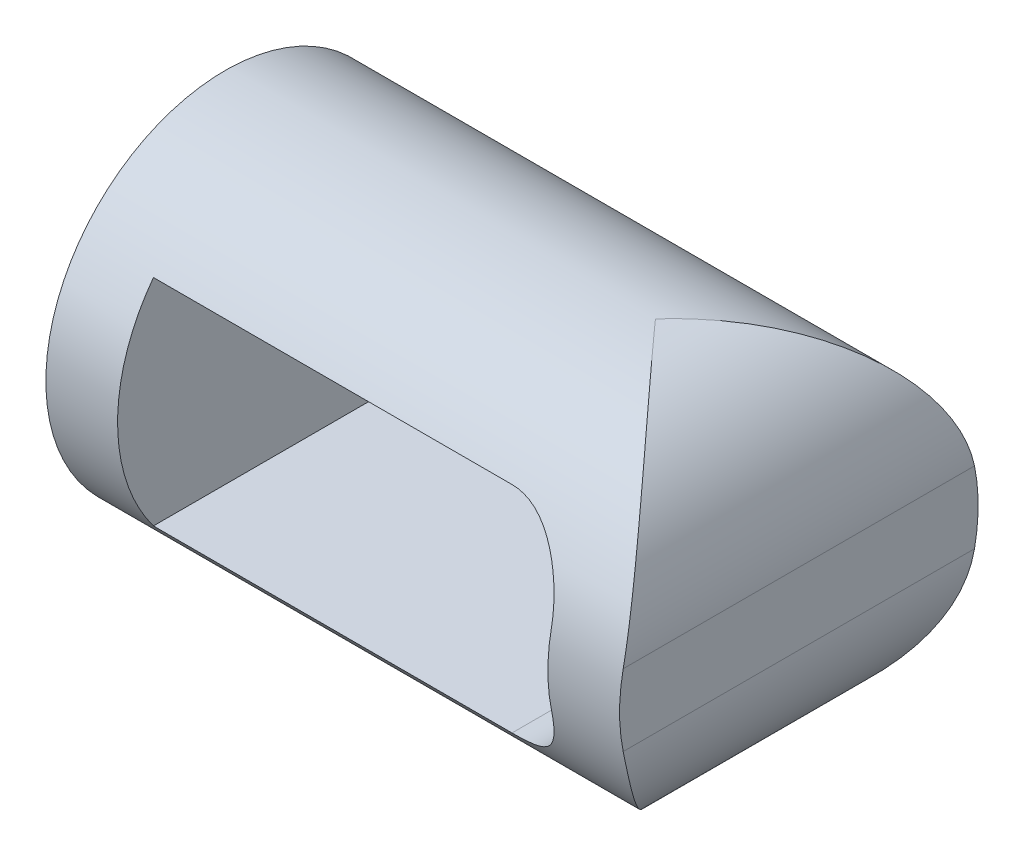
from build123d import *

# Parameters (mm, degrees)
SKETCH1_R               = 12.5
BOSS_EXTRUDE4_DEPTH     = 40
CUT_EXTRUDE2_DEPTH      = 44.732139211
CUT_EXTRUDE2_DEPTH_BACK = 44.732139211
CUT_EXTRUDE6_DEPTH      = 44.73213936
CUT_EXTRUDE6_DEPTH_BACK = 44.73213936
CUT_EXTRUDE7_DEPTH      = 44.73213936
CUT_EXTRUDE7_DEPTH_BACK = 44.73213936


with BuildPart() as part:
    # Sketch1 → Boss-Extrude4 (new body)
    with BuildSketch(Plane(origin=(0, 0, 0), x_dir=(0, 0, -1), z_dir=(1, 0, 0))):
        Circle(SKETCH1_R)
    extrude(amount=BOSS_EXTRUDE4_DEPTH)

    # Sketch2 → Cut-Extrude2 (cut, two sides: drawn at the far end of the back side and taken through both)
    with BuildSketch(Plane.XY.offset(-CUT_EXTRUDE2_DEPTH_BACK)):
        with BuildLine():
            Line((5, 0), (5, 7.5))
            Line((5, 7.5), (30, 7.5))
            ThreePointArc((30, 7.5), (33.535533906, 6.035533906), (35, 2.5))
            Line((35, 2.5), (35, -2.5))
            ThreePointArc((35, -2.5), (33.535533906, -6.035533906), (30, -7.5))
            Line((30, -7.5), (5, -7.5))
            Line((5, -7.5), (5, 0))
        make_face()
    extrude(amount=CUT_EXTRUDE2_DEPTH + CUT_EXTRUDE2_DEPTH_BACK, mode=Mode.SUBTRACT)

    # Sketch4 → Cut-Extrude6 (cut, two sides: drawn at the far end of the back side and taken through both)
    with BuildSketch(Plane.XY.offset(-CUT_EXTRUDE6_DEPTH_BACK)):
        with BuildLine():
            Line((30, 12.5), (40, 12.5))
            Line((40, 12.5), (40, 2.5))
            ThreePointArc((40, 2.5), (37.071067812, 9.571067812), (30, 12.5))
        make_face()
    extrude(amount=CUT_EXTRUDE6_DEPTH + CUT_EXTRUDE6_DEPTH_BACK, mode=Mode.SUBTRACT)

    # Sketch5 → Cut-Extrude7 (cut, two sides: drawn at the far end of the back side and taken through both)
    with BuildSketch(Plane.XY.offset(-CUT_EXTRUDE7_DEPTH_BACK)):
        with BuildLine():
            Line((30, -12.5), (40, -12.5))
            Line((40, -12.5), (40, -2.5))
            ThreePointArc((40, -2.5), (37.071067812, -9.571067812), (30, -12.5))
        make_face()
    extrude(amount=CUT_EXTRUDE7_DEPTH + CUT_EXTRUDE7_DEPTH_BACK, mode=Mode.SUBTRACT)


solid = part.part
